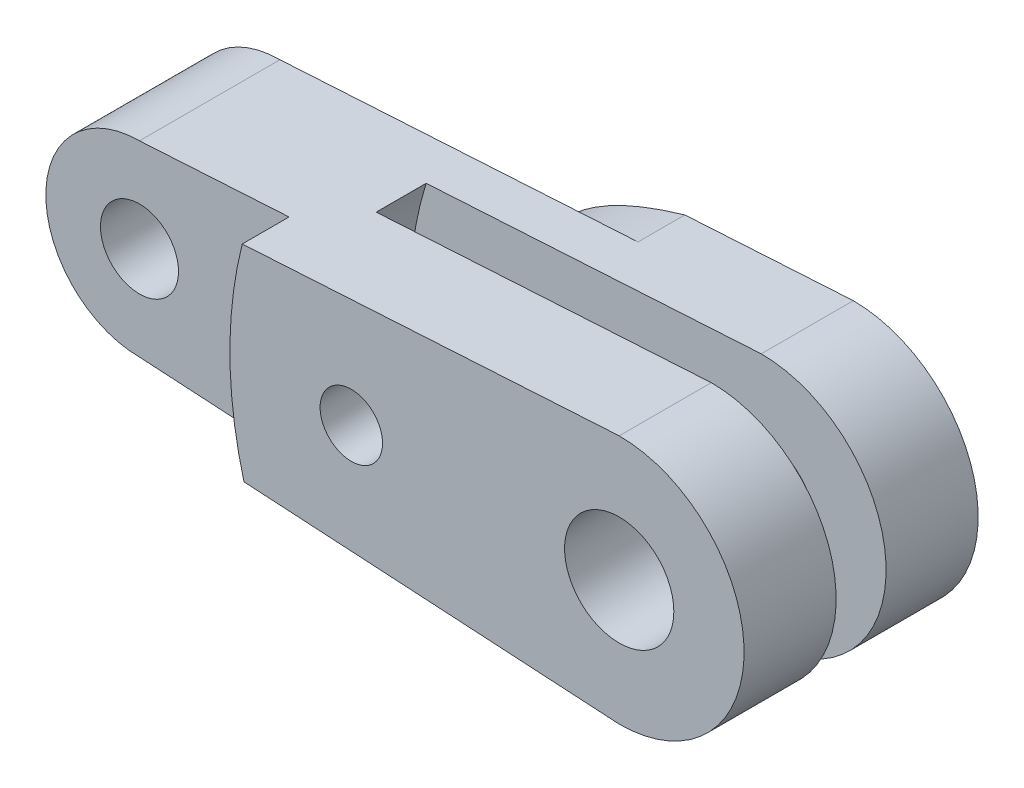
from build123d import *

# Parameters (mm, degrees)
SKETCH_1_R          = 3.5
EXTRUDE_1_DEPTH     = 15
CUT_EXTRUDE_1_DEPTH = 3.2
CUT_EXTRUDE_2_DEPTH = 3
CUT_EXTRUDE_3_DEPTH = 3
SKETCH_5_R          = 2.5
CUT_EXTRUDE_4_DEPTH = 15
SKETCH_6_R          = 2
CUT_EXTRUDE_5_DEPTH = 15


with BuildPart() as part:
    # Эскиз1 → Вытянуть1 (new body)
    with BuildSketch(Plane.XY):
        with BuildLine():
            Line((-33.737889323, 6), (0, 8))
            ThreePointArc((0, 8), (8, 0), (0, -8))
            Line((0, -8), (-33.737889323, -6))
            ThreePointArc((-33.737889323, -6), (-39.737889323, 0), (-33.737889323, 6))
        make_face()
        Circle(SKETCH_1_R, mode=Mode.SUBTRACT)
    extrude(amount=EXTRUDE_1_DEPTH)

    # Эскиз2 → Вырез-Вытянуть1 (cut)
    with BuildSketch(Plane.XY.offset(9.1)):
        with BuildLine():
            Line((-21.470788926, 6.727200228), (-0.649375953, 7.973600872))
            Line((-0.649375953, 7.973600872), (-0.649375953, 12.464774984))
            Line((-0.649375953, 12.464774984), (11.53167748, 12.464774984))
            Line((11.53167748, 12.464774984), (11.53167748, -11.583586667))
            Line((11.53167748, -11.583586667), (-0.649375953, -11.583586667))
            Line((-0.649375953, -11.583586667), (-0.649375953, -7.973600872))
            Line((-0.649375953, -7.973600872), (-21.470788926, -6.727200228))
            ThreePointArc((-21.470788926, -6.727200228), (-22.5, 0), (-21.470788926, 6.727200228))
        make_face()
    extrude(amount=-CUT_EXTRUDE_1_DEPTH, mode=Mode.SUBTRACT)

    # Эскиз3 → Вырез-Вытянуть2 (cut)
    with BuildSketch(Plane.XY.offset(15)):
        with BuildLine():
            Line((-58.585224431, 9.320685439), (-23.289981774, 9.320685439))
            ThreePointArc((-23.289981774, 9.320685439), (-24.945775434, 0.205603355), (-23.289981774, -8.909478729))
            Line((-23.289981774, -8.909478729), (-58.585224431, -8.909478729))
            Line((-58.585224431, -8.909478729), (-58.585224431, 9.320685439))
        make_face()
    extrude(amount=-CUT_EXTRUDE_2_DEPTH, mode=Mode.SUBTRACT)

    # Эскиз4 → Вырез-Вытянуть3 (cut)
    with BuildSketch(Plane(origin=(0, 0, 0), x_dir=(-1, 0, 0), z_dir=(0, 0, -1))):
        with BuildLine():
            Line((7.501860508, 8.168918957), (7.501860508, 9.225490058))
            Line((7.501860508, 9.225490058), (56.423561983, 9.225490058))
            Line((56.423561983, 9.225490058), (56.423561983, -10.745771297))
            Line((56.423561983, -10.745771297), (16.608517708, -10.745771297))
            Line((16.608517708, -10.745771297), (16.608517708, -7.871583169))
            add(Edge.make_bspline(
                [(7.501860508, 8.168918957), (26.545638359, 4.198485706), (16.608517708, -7.871583169)],
                knots=[0, 0, 0, 1, 1, 1], degree=2))
        make_face()
    extrude(amount=-CUT_EXTRUDE_3_DEPTH, mode=Mode.SUBTRACT)

    # Эскиз5 → Вырез-Вытянуть4 (cut)
    with BuildSketch(Plane.XY.offset(12)):
        with Locations((-33.737889323, 0)):
            Circle(SKETCH_5_R)
    extrude(amount=-CUT_EXTRUDE_4_DEPTH, mode=Mode.SUBTRACT)

    # Эскиз6 → Вырез-Вытянуть5 (cut)
    with BuildSketch(Plane.XY.offset(15)):
        with Locations((-17.165585922, 0)):
            Circle(SKETCH_6_R)
    extrude(amount=-CUT_EXTRUDE_5_DEPTH, mode=Mode.SUBTRACT)


solid = part.part
